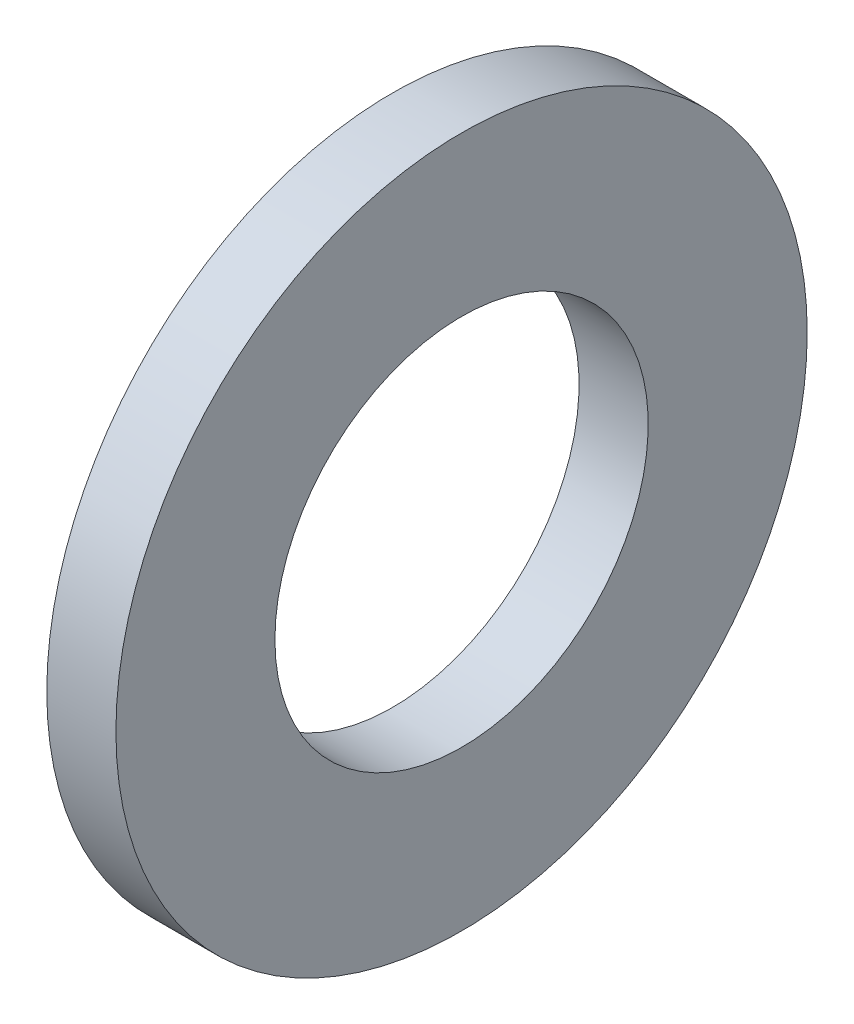
from build123d import *

# Parameters (mm, degrees)
SKETCH1_W = 0.5
SKETCH1_H = 1.15


with BuildPart() as part:
    # Sketch1 → Base-Revolve (revolve)
    with BuildSketch(Plane.XY, mode=Mode.PRIVATE) as base_revolve_sk:
        with Locations((-0.25, 1.925)):
            Rectangle(SKETCH1_W, SKETCH1_H)
    revolve(base_revolve_sk.sketch.rotate(Axis((-34.925, 0, 0), (1, 0, 0)), 90), axis=Axis((-34.925, 0, 0), (1, 0, 0)))


solid = part.part
